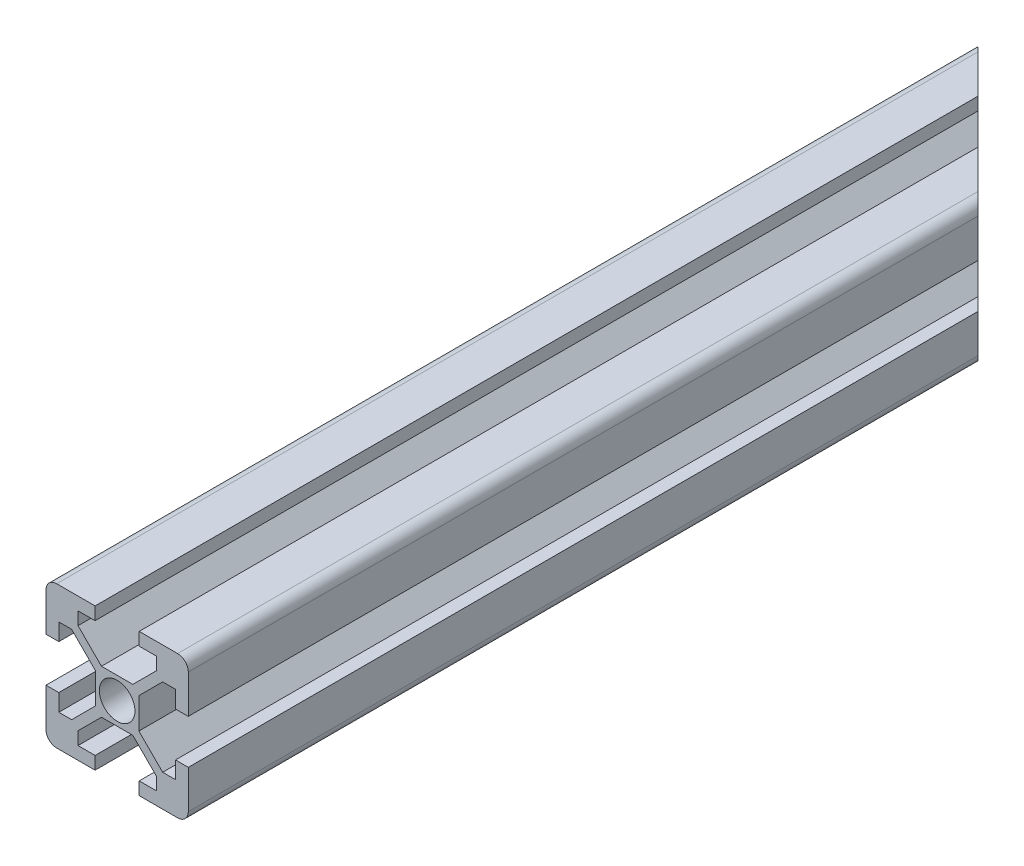
from build123d import *

# Parameters (mm, degrees)
SKETCH_1_R          = 2.5
EXTRUDE_1_DEPTH     = 371
CUT_EXTRUDE_1_DEPTH = 372.673243589
SKETCH_3_W          = 49.042761982
SKETCH_3_H          = 45.736729066
CUT_EXTRUDE_2_DEPTH = 240


with BuildPart() as part:
    # 草图1 → 凸台-拉伸1 (new body)
    with BuildSketch(Plane.XY):
        with BuildLine():
            Line((-8.2, -3.1), (-10, -3.1))
            Line((-10, -3.1), (-10, -8.5))
            ThreePointArc((-10, -8.5), (-9.560660172, -9.560660172), (-8.5, -10))
            Line((-8.5, -10), (-3.1, -10))
            Line((-3.1, -10), (-3.1, -8.2))
            Line((-3.1, -8.2), (-5.5, -8.2))
            Line((-5.5, -8.2), (-5.5, -6.397050155))
            Line((-5.5, -6.397050155), (-2.202949845, -3.1))
            Line((-2.202949845, -3.1), (2.202949845, -3.1))
            Line((2.202949845, -3.1), (5.5, -6.397050155))
            Line((5.5, -6.397050155), (5.5, -8.2))
            Line((5.5, -8.2), (3.1, -8.2))
            Line((3.1, -8.2), (3.1, -10))
            Line((3.1, -10), (8.5, -10))
            ThreePointArc((8.5, -10), (9.560660172, -9.560660172), (10, -8.5))
            Line((10, -8.5), (10, -3.1))
            Line((10, -3.1), (8.2, -3.1))
            Line((8.2, -3.1), (8.2, -5.5))
            Line((8.2, -5.5), (6.397050155, -5.5))
            Line((6.397050155, -5.5), (3.05412702, -2.157076865))
            Line((3.05412702, -2.157076865), (3.05412702, 2.157076865))
            Line((3.05412702, 2.157076865), (6.397050155, 5.5))
            Line((6.397050155, 5.5), (8.2, 5.5))
            Line((8.2, 5.5), (8.2, 3.1))
            Line((8.2, 3.1), (10, 3.1))
            Line((10, 3.1), (10, 8.5))
            ThreePointArc((10, 8.5), (9.560660172, 9.560660172), (8.5, 10))
            Line((8.5, 10), (3.1, 10))
            Line((3.1, 10), (3.1, 8.2))
            Line((3.1, 8.2), (5.5, 8.2))
            Line((5.5, 8.2), (5.5, 6.397050155))
            Line((5.5, 6.397050155), (2.202949845, 3.1))
            Line((2.202949845, 3.1), (-2.202949845, 3.1))
            Line((-2.202949845, 3.1), (-5.5, 6.397050155))
            Line((-5.5, 6.397050155), (-5.5, 8.2))
            Line((-5.5, 8.2), (-3.1, 8.2))
            Line((-3.1, 8.2), (-3.1, 10))
            Line((-3.1, 10), (-8.5, 10))
            ThreePointArc((-8.5, 10), (-9.560660172, 9.560660172), (-10, 8.5))
            Line((-10, 8.5), (-10, 3.1))
            Line((-10, 3.1), (-8.2, 3.1))
            Line((-8.2, 3.1), (-8.2, 5.5))
            Line((-8.2, 5.5), (-6.397050155, 5.5))
            Line((-6.397050155, 5.5), (-3.05412702, 2.157076865))
            Line((-3.05412702, 2.157076865), (-3.05412702, -2.157076865))
            Line((-3.05412702, -2.157076865), (-6.397050155, -5.5))
            Line((-6.397050155, -5.5), (-8.2, -5.5))
            Line((-8.2, -5.5), (-8.2, -3.1))
        make_face()
        Circle(SKETCH_1_R, mode=Mode.SUBTRACT)
    extrude(amount=EXTRUDE_1_DEPTH)

    # 草图2 → 切除-拉伸1 (cut, through all)
    with BuildSketch(Plane(origin=(0, 10, 0), x_dir=(1, 0, 0), z_dir=(0, 1, 0))):
        Polygon((10, 0), (10, -20), (-10, 0), align=None)
    extrude(amount=-CUT_EXTRUDE_1_DEPTH, mode=Mode.SUBTRACT)

    # 草图3 → 切除-拉伸2 (cut)
    with BuildSketch(Plane.XY.offset(371)):
        with Locations((9.560660172, -9.560660172)):
            Rectangle(SKETCH_3_W, SKETCH_3_H)
    extrude(amount=-CUT_EXTRUDE_2_DEPTH, mode=Mode.SUBTRACT)


solid = part.part
